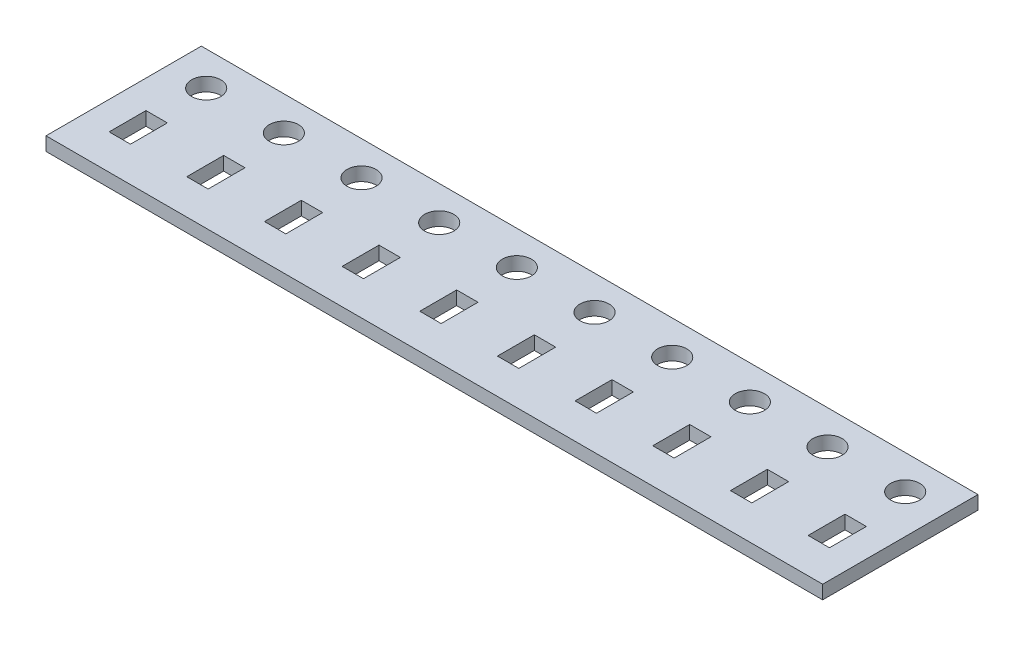
from build123d import *

# Parameters (mm, degrees)
SKETCH_1_W             = 4
SKETCH_1_H             = 8
SKETCH_1_R             = 0.75
SKETCH_1_W_2           = 1.1
SKETCH_1_H_2           = 1.9
EXTRUDE_1_DEPTH        = 0.7
PATTERN_LINEAR_2_COUNT = 10
PATTERN_LINEAR_2_PITCH = 4


with BuildPart() as part:
    # 草图1 → 凸台-拉伸1 (new body)
    with BuildSketch(Plane(origin=(0, 0, 0), x_dir=(1, 0, 0), z_dir=(0, 1, 0))):
        with Locations((0, 4)):
            Rectangle(SKETCH_1_W, SKETCH_1_H)
        with Locations(Location((0, 6.25, 0), (0, 0, 270))):
            Circle(SKETCH_1_R, mode=Mode.SUBTRACT)
        with Locations((0, 2.75)):
            Rectangle(SKETCH_1_W_2, SKETCH_1_H_2, mode=Mode.SUBTRACT)
    extrude_1 = extrude(amount=EXTRUDE_1_DEPTH)

    # 阵列(线性)2: 凸台-拉伸1 ×10
    with Locations(*[(i * PATTERN_LINEAR_2_PITCH, 0, 0) for i in range(1, PATTERN_LINEAR_2_COUNT)]):
        add(extrude_1)


solid = part.part
